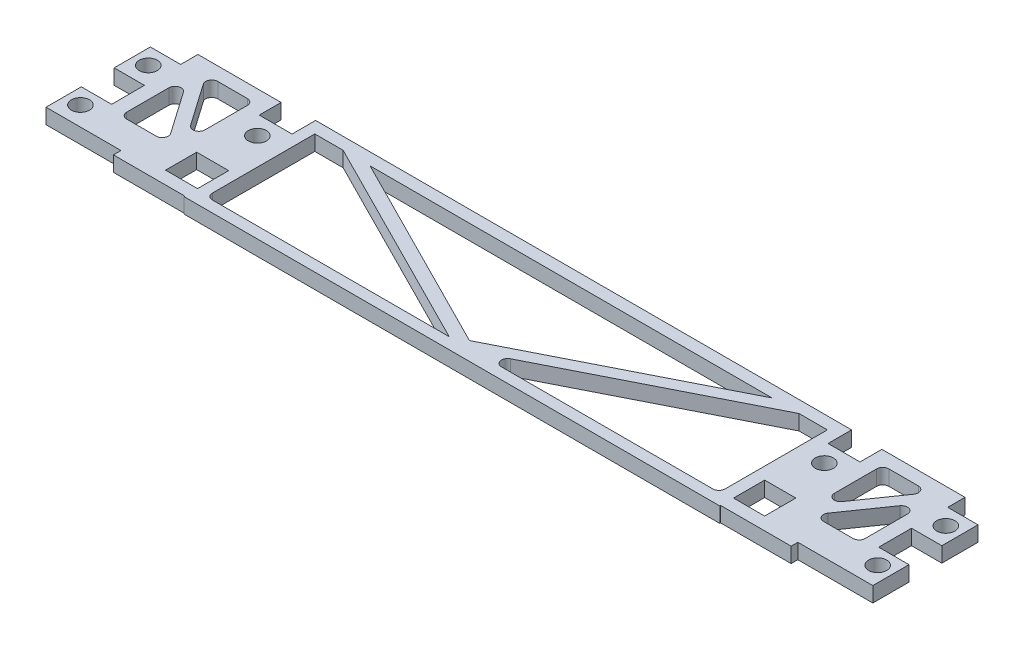
from build123d import *

# Parameters (mm, degrees)
SKETCH1_W                 = 6.7056
SKETCH1_H                 = 6.5278
SKETCH1_W_2               = 6.5278
BOSS_EXTRUDE1_DEPTH       = 3.175
F_6_CLEARANCE_HOLE1_D     = 3.7973
F_6_CLEARANCE_HOLE1_DEPTH = 6.35
F_6_CLEARANCE_HOLE1_TIP   = 1.140824014
FILLET1_R                 = 1.27


with BuildPart() as part:
    # Sketch1 → Boss-Extrude1 (new body)
    with BuildSketch(Plane(origin=(0, 0, 0), x_dir=(1, 0, 0), z_dir=(0, 1, 0))):
        Polygon((127.426380641, 27.563643867), (15.082180641, 27.563643867), (15.082180641, 22.623343867), (8.198780641, 22.623343867), (8.198780641, 27.208043867), (-9.225619359, 27.208043867), (-9.225619359, 23.575843867), (-15.575619359, 23.575843867), (-15.575619359, 15.993943867), (-9.225619359, 15.993943867), (-9.225619359, 9.110543867), (-15.575619359, 9.110543867), (-15.575619359, 1.706443867), (0.1397, 1.706443867), (0.1397, 0.118943867), (15.082180641, 0.118943867), (15.082180641, -0.058856133), (127.426380641, -0.058856133), (127.426380641, 0.118943867), (142.191061281, 0.118943867), (142.191061281, 1.528643867), (157.906380641, 1.528643867), (157.906380641, 9.110543867), (151.556380641, 9.110543867), (151.556380641, 15.993943867), (157.906380641, 15.993943867), (157.906380641, 23.575843867), (151.556380641, 23.575843867), (151.556380641, 27.208043867), (134.131980641, 27.208043867), (134.131980641, 22.623343867), (127.426380641, 22.623343867), align=None)
        with Locations((11.729380641, 6.075243867)):
            Rectangle(SKETCH1_W, SKETCH1_H, mode=Mode.SUBTRACT)
        Polygon((68.349676501, 2.303343867), (17.444380641, 2.303343867), (17.444380641, 25.023643867), (23.391676501, 25.023643867), align=None, mode=Mode.SUBTRACT)
        with Locations((130.690280641, 6.075243867)):
            Rectangle(SKETCH1_W_2, SKETCH1_H, mode=Mode.SUBTRACT)
        Polygon((73.981084781, 2.303343867), (118.939084781, 25.023643867), (124.886380641, 25.023643867), (124.886380641, 2.303343867), align=None, mode=Mode.SUBTRACT)
        Polygon((-6.228419359, 8.001876918), (-6.228419359, 22.168725531), (3.653156436, 8.001876918), align=None, mode=Mode.SUBTRACT)
        Polygon((-4.679995154, 24.388643867), (5.201580641, 24.388643867), (5.201580641, 10.221795255), align=None, mode=Mode.SUBTRACT)
        Polygon((113.307676501, 25.023643867), (71.165380641, 3.726308474), (29.023084781, 25.023643867), align=None, mode=Mode.SUBTRACT)
        Polygon((148.559180641, 22.168725531), (148.559180641, 8.001876918), (138.677604846, 8.001876918), align=None, mode=Mode.SUBTRACT)
        Polygon((137.129180641, 24.388643867), (147.010756436, 24.388643867), (137.129180641, 10.221795255), align=None, mode=Mode.SUBTRACT)
    extrude(amount=BOSS_EXTRUDE1_DEPTH)

    # #6 Clearance Hole1
    with Locations(Plane(origin=(0.024087856, 3.175, -12.509508824), x_dir=(-1, 0, 0), z_dir=(0, 1, 0))):
        with Locations((-130.577292784, -6.164135043), (-154.707292784, -7.499674703), (-154.707292784, 6.787825297), (-11.737042784, -6.164130843), (12.392957216, 6.787829497), (12.462807216, -7.499674703)):
            Hole(F_6_CLEARANCE_HOLE1_D / 2, depth=F_6_CLEARANCE_HOLE1_DEPTH)
            with Locations((0, 0, -(F_6_CLEARANCE_HOLE1_DEPTH + F_6_CLEARANCE_HOLE1_TIP / 2))):  # 118° drill point
                Cone(0, F_6_CLEARANCE_HOLE1_D / 2, F_6_CLEARANCE_HOLE1_TIP, mode=Mode.SUBTRACT)

    # Fillet1
    fillet1_edges = [part.edges().sort_by_distance(p)[0] for p in [
        (-6.228419359, 1.5875, -22.168725531),
        (-6.228419359, 1.5875, -8.001876918),
        (3.653156436, 1.5875, -8.001876918),
        (124.886380641, 1.5875, -2.303343867),
        (73.981084781, 1.5875, -2.303343867),
        (17.444380641, 1.5875, -2.303343867),
        (138.677604846, 1.5875, -8.001876918),
        (148.559180641, 1.5875, -8.001876918),
        (148.559180641, 1.5875, -22.168725531),
        (137.129180641, 1.5875, -24.388643867),
        (137.129180641, 1.5875, -10.221795255),
        (147.010756436, 1.5875, -24.388643867),
        (5.201580641, 1.5875, -10.221795255),
        (5.201580641, 1.5875, -24.388643867),
        (-4.679995154, 1.5875, -24.388643867),
    ]]
    fillet(fillet1_edges, radius=FILLET1_R)


solid = part.part
